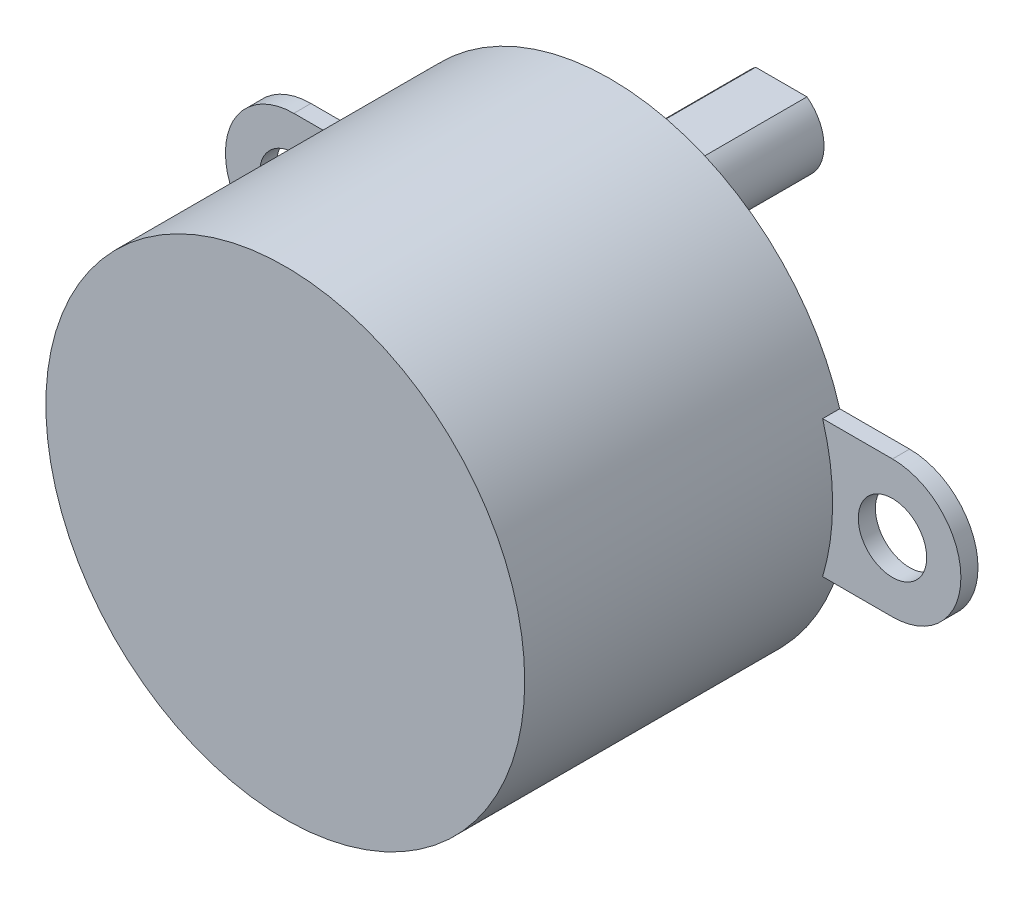
from build123d import *

# Parameters (mm, degrees)
SKETCH_1_R          = 14
EXTRUDE_1_DEPTH     = 19
SKETCH_3_R          = 4
EXTRUDE_2_DEPTH     = 1.8
SKETCH_4_R          = 2.5
EXTRUDE_3_DEPTH     = 8.2
SKETCH_5_R          = 2
EXTRUDE_4_DEPTH     = 1
CUT_EXTRUDE_START   = -8.2
CUT_EXTRUDE_1_DEPTH = 8.2


with BuildPart() as part:
    # 草图1 → 凸台-拉伸1 (new body)
    with BuildSketch(Plane.XY):
        Circle(SKETCH_1_R)
    extrude(amount=EXTRUDE_1_DEPTH)

    # 草图3 → 凸台-拉伸2 (add)
    with BuildSketch(Plane.XY):
        with Locations((0, 6.835245796)):
            Circle(SKETCH_3_R)
    extrude(amount=-EXTRUDE_2_DEPTH)

    # 草图4 → 凸台-拉伸3 (add)
    with BuildSketch(Plane(origin=(0, 0, -1.8), x_dir=(-1, 0, 0), z_dir=(0, 0, -1))):
        with Locations((0, 6.835245796)):
            Circle(SKETCH_4_R)
    extrude(amount=EXTRUDE_3_DEPTH)

    # 草图5 → 凸台-拉伸4 (add)
    with BuildSketch(Plane(origin=(0, 0, 0), x_dir=(-1, 0, 0), z_dir=(0, 0, -1))):
        with BuildLine():
            Line((-17.5, 4), (17.5, 4))
            ThreePointArc((17.5, 4), (21.5, 0), (17.5, -4))
            Line((17.5, -4), (-17.5, -4))
            ThreePointArc((-17.5, -4), (-21.5, 0), (-17.5, 4))
        make_face()
        with Locations((17.5, 0)):
            Circle(SKETCH_5_R, mode=Mode.SUBTRACT)
        with Locations((-17.5, 0)):
            Circle(SKETCH_5_R, mode=Mode.SUBTRACT)
    extrude(amount=-EXTRUDE_4_DEPTH)

    # 草图6 → 切除-拉伸1 (cut)
    with BuildSketch(Plane(origin=(0, 0, -10), x_dir=(-1, 0, 0), z_dir=(0, 0, -1)).offset(CUT_EXTRUDE_START)):
        with BuildLine():
            Line((-1.5, 8.835245796), (1.5, 8.835245796))
            ThreePointArc((1.5, 8.835245796), (0, 9.335245796), (-1.5, 8.835245796))
        make_face()
        with BuildLine():
            Line((1.5, 4.835245796), (-1.5, 4.835245796))
            ThreePointArc((-1.5, 4.835245796), (0, 4.335245796), (1.5, 4.835245796))
        make_face()
    extrude(amount=CUT_EXTRUDE_1_DEPTH, mode=Mode.SUBTRACT)


solid = part.part
